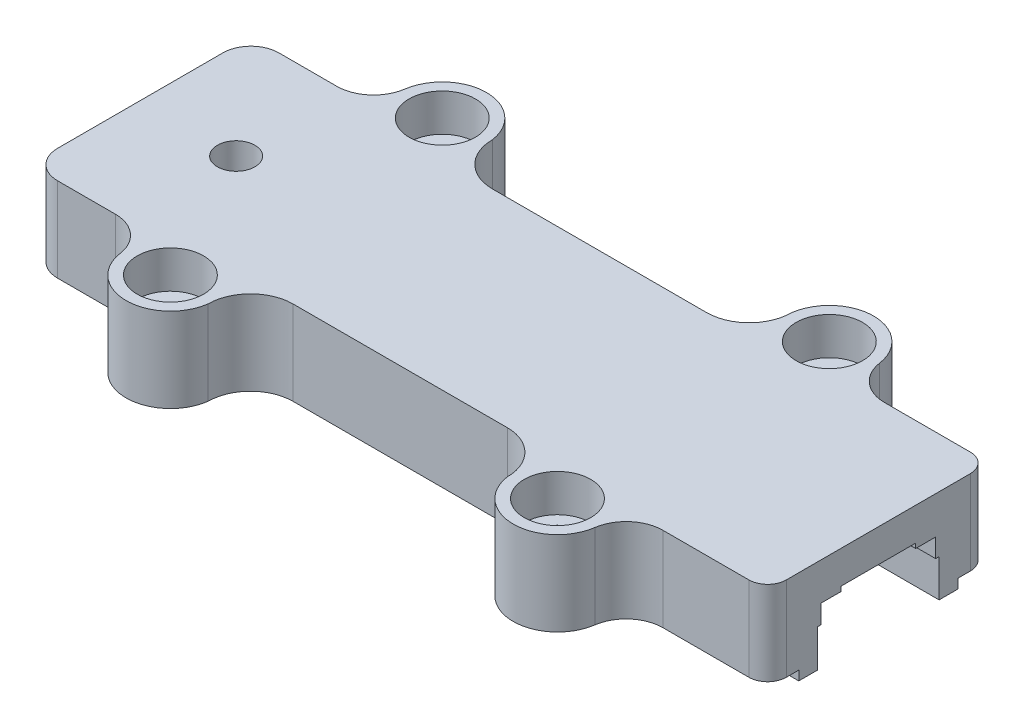
from build123d import *

# Parameters (mm, degrees)
SKETCH1_W           = 100
SKETCH1_H           = 30
BOSS_EXTRUDE1_DEPTH = 12.7
SKETCH2_W           = 15.2
SKETCH2_H           = 7.62
CUT_EXTRUDE1_DEPTH  = 102.913149299
SKETCH3_W           = 0.635
SKETCH3_H           = 5.08
SKETCH3_W_2         = 10.12
SKETCH3_H_2         = 0.635
CUT_EXTRUDE2_DEPTH  = 102.913149299
BOSS_EXTRUDE2_REACH = 103.913
SKETCH4_W           = 5
SKETCH4_H           = 16.47
FILLET7_R           = 1.5875
FILLET8_R           = 1.5875
BOSS_EXTRUDE3_REACH = 103.405
SKETCH9_W           = 19.05
SKETCH9_H           = 10.12
SKETCH7_R           = 2.54
CUT_EXTRUDE4_DEPTH  = 102.405445613
SKETCH10_R          = 3.175
CUT_EXTRUDE6_DEPTH  = 1.27
FILLET5_R           = 1.5875
BOSS_EXTRUDE4_DEPTH = 12.7
SKETCH12_R          = 4.5
CUT_EXTRUDE7_DEPTH  = 5.08
SKETCH13_R          = 2.75
CUT_EXTRUDE8_DEPTH  = 104.218974152
FILLET6_R           = 5
CUT_EXTRUDE9_START  = -1.27
CUT_EXTRUDE9_DEPTH  = 1.27
SKETCH25_W          = 3.175
SKETCH25_H          = 2.54
BOSS_EXTRUDE5_DEPTH = 2.54
BOSS_EXTRUDE6_REACH = 82.186
SKETCH26_W          = 2.54
SKETCH26_H          = 2.54
SKETCH31_W          = 0.1651
SKETCH31_H          = 2.54
ADJUST_DEPTH        = 72.14
FILLET9_R           = 1.5875
CUT_EXTRUDE10_DEPTH = 104.569962596
FILLET10_R          = 3.81
FILLET11_R          = 2.54


with BuildPart() as part:
    # Sketch1 → Boss-Extrude1 (new body)
    with BuildSketch(Plane(origin=(0, 0, 0), x_dir=(1, 0, 0), z_dir=(0, 1, 0))):
        with Locations((50, 0)):
            Rectangle(SKETCH1_W, SKETCH1_H)
    extrude(amount=BOSS_EXTRUDE1_DEPTH)

    # Sketch2 → Cut-Extrude1 (cut, through all)
    with BuildSketch(Plane(origin=(100, 0, 0), x_dir=(0, 0, -1), z_dir=(1, 0, 0))):
        with Locations((0, 3.81)):
            Rectangle(SKETCH2_W, SKETCH2_H)
    extrude(amount=-CUT_EXTRUDE1_DEPTH, mode=Mode.SUBTRACT)

    # Sketch3 → Cut-Extrude2 (cut, through all)
    with BuildSketch(Plane(origin=(100, 0, 0), x_dir=(0, 0, -1), z_dir=(1, 0, 0))):
        with Locations((-7.9175, 2.54)):
            Rectangle(SKETCH3_W, SKETCH3_H)
        with Locations((0, 7.9375)):
            Rectangle(SKETCH3_W_2, SKETCH3_H_2)
        with Locations((7.9175, 2.54)):
            Rectangle(SKETCH3_W, SKETCH3_H)
    extrude(amount=-CUT_EXTRUDE2_DEPTH, mode=Mode.SUBTRACT)

    # Sketch4 → Boss-Extrude2 (add, up to next)
    with BuildSketch(Plane.XZ, mode=Mode.PRIVATE) as boss_extrude2_sk1:
        with Locations((2.5, 0)):
            Rectangle(SKETCH4_W, SKETCH4_H)
    boss_extrude2_tool1 = extrude(boss_extrude2_sk1.sketch, amount=-BOSS_EXTRUDE2_REACH, mode=Mode.PRIVATE) - part.part
    add(boss_extrude2_tool1.solids().sort_by_distance((2.5, 0, 0))[0])

    # Fillet7
    fillet7_edges = [part.edges().sort_by_distance(p)[0] for p in [
        (5, 6.35, 7.6),
        (5, 6.35, -7.6),
    ]]
    fillet(fillet7_edges, radius=FILLET7_R)

    # Fillet8
    fillet8_edges = [part.edges().sort_by_distance(p)[0] for p in [
        (5, 2.54, 8.235),
        (5, 2.54, -8.235),
    ]]
    fillet(fillet8_edges, radius=FILLET8_R)

    # Sketch9 → Boss-Extrude3 (add, up to next)
    with BuildSketch(Plane.XZ.offset(-7.62), mode=Mode.PRIVATE) as boss_extrude3_sk1:
        with Locations((14.525, 0)):
            Rectangle(SKETCH9_W, SKETCH9_H)
    boss_extrude3_tool1 = extrude(boss_extrude3_sk1.sketch, amount=-BOSS_EXTRUDE3_REACH, mode=Mode.PRIVATE) - part.part
    add(boss_extrude3_tool1.solids().sort_by_distance((14.525, 7.62, 0))[0])

    # Sketch7 → Cut-Extrude4 (cut, through all)
    with BuildSketch(Plane.XZ.offset(-7.62)):
        with Locations(Location((13, 0, 0), (0, 0, 270))):
            Circle(SKETCH7_R)
    extrude(amount=-CUT_EXTRUDE4_DEPTH, mode=Mode.SUBTRACT)

    # Sketch10 → Cut-Extrude6 (cut)
    with BuildSketch(Plane.XZ.offset(-7.62)):
        with Locations(Location((13, 0, 0), (0, 0, 270))):
            Circle(SKETCH10_R)
    extrude(amount=-CUT_EXTRUDE6_DEPTH, mode=Mode.SUBTRACT)

    # Fillet5
    fillet5_edges = [part.edges().sort_by_distance(p)[0] for p in [
        (24.05, 7.9375, 5.06),
        (24.05, 7.9375, -5.06),
    ]]
    fillet(fillet5_edges, radius=FILLET5_R)

    # Sketch11 → Boss-Extrude4 (add)
    with BuildSketch(Plane(origin=(0, 12.7, 0), x_dir=(1, 0, 0), z_dir=(0, 1, 0))):
        with BuildLine():
            Line((68.95, -15), (68.95, -18.415))
            ThreePointArc((68.95, -18.415), (74.95, -24.415), (80.95, -18.415))
            Line((80.95, -18.415), (80.95, -15))
            Line((80.95, -15), (68.95, -15))
        make_face()
        with BuildLine():
            Line((28.51, -18.415), (28.51, -15))
            Line((28.51, -15), (16.51, -15))
            Line((16.51, -15), (16.51, -18.415))
            ThreePointArc((16.51, -18.415), (22.51, -24.415), (28.51, -18.415))
        make_face()
    boss_extrude4 = extrude(amount=-BOSS_EXTRUDE4_DEPTH)

    # Sketch12 → Cut-Extrude7 (cut)
    with BuildSketch(Plane(origin=(0, 12.7, 0), x_dir=(1, 0, 0), z_dir=(0, 1, 0))):
        with Locations(Location((22.51, -18.415, 0), (0, 0, 270))):
            Circle(SKETCH12_R)
        with Locations(Location((74.95, -18.415, 0), (0, 0, 270))):
            Circle(SKETCH12_R)
    cut_extrude7 = extrude(amount=-CUT_EXTRUDE7_DEPTH, mode=Mode.SUBTRACT)

    # Sketch13 → Cut-Extrude8 (cut, through all)
    with BuildSketch(Plane(origin=(0, 7.62, 0), x_dir=(1, 0, 0), z_dir=(0, 1, 0))):
        with Locations(Location((22.51, -18.415, 0), (0, 0, 270))):
            Circle(SKETCH13_R)
        with Locations(Location((74.95, -18.415, 0), (0, 0, 270))):
            Circle(SKETCH13_R)
    cut_extrude8 = extrude(amount=-CUT_EXTRUDE8_DEPTH, mode=Mode.SUBTRACT)

    # Mirror1: Boss-Extrude4, Cut-Extrude7, Cut-Extrude8 across plane
    add(boss_extrude4.mirror(Plane.XY))
    add(cut_extrude7.mirror(Plane.XY), mode=Mode.SUBTRACT)
    add(cut_extrude8.mirror(Plane.XY), mode=Mode.SUBTRACT)

    # Fillet6
    fillet6_edges = [part.edges().sort_by_distance(p)[0] for p in [
        (16.51, 6.35, 15),
        (28.51, 6.35, 15),
        (68.95, 6.35, 15),
        (80.95, 6.35, 15),
        (80.95, 6.35, -15),
        (68.95, 6.35, -15),
        (16.51, 6.35, -15),
        (28.51, 6.35, -15),
    ]]
    fillet(fillet6_edges, radius=FILLET6_R)

    # Sketch24 → Cut-Extrude9 (cut)
    with BuildSketch(Plane.XZ.offset(CUT_EXTRUDE9_START)):
        with BuildLine():
            Line((100, -10.775), (6.5875, -10.775))
            ThreePointArc((6.5875, -10.775), (3.668916761, -9.566083239), (2.46, -6.6475))
            Line((2.46, -6.6475), (2.46, 6.6475))
            ThreePointArc((2.46, 6.6475), (3.668916761, 9.566083239), (6.5875, 10.775))
            Line((6.5875, 10.775), (100, 10.775))
            Line((100, 10.775), (100, 15))
            Line((100, 15), (85.835209001, 15))
            ThreePointArc((85.835209001, 15), (82.564297257, 16.218315671), (80.887386728, 19.279545455))
            ThreePointArc((80.887386728, 19.279545455), (74.95, 24.415), (69.012613272, 19.279545455))
            ThreePointArc((69.012613272, 19.279545455), (67.335702743, 16.218315671), (64.064790999, 15))
            Line((64.064790999, 15), (33.395209001, 15))
            ThreePointArc((33.395209001, 15), (30.124297257, 16.218315671), (28.447386728, 19.279545455))
            ThreePointArc((28.447386728, 19.279545455), (22.51, 24.415), (16.572613272, 19.279545455))
            ThreePointArc((16.572613272, 19.279545455), (14.895702743, 16.218315671), (11.624790999, 15))
            Line((11.624790999, 15), (0, 15))
            Line((0, 15), (0, -15))
            Line((0, -15), (11.624790999, -15))
            ThreePointArc((11.624790999, -15), (14.895702743, -16.218315671), (16.572613272, -19.279545455))
            ThreePointArc((16.572613272, -19.279545455), (22.51, -24.415), (28.447386728, -19.279545455))
            ThreePointArc((28.447386728, -19.279545455), (30.124297257, -16.218315671), (33.395209001, -15))
            Line((33.395209001, -15), (64.064790999, -15))
            ThreePointArc((64.064790999, -15), (67.335702743, -16.218315671), (69.012613272, -19.279545455))
            ThreePointArc((69.012613272, -19.279545455), (74.95, -24.415), (80.887386728, -19.279545455))
            ThreePointArc((80.887386728, -19.279545455), (82.564297257, -16.218315671), (85.835209001, -15))
            Line((85.835209001, -15), (100, -15))
            Line((100, -15), (100, -10.775))
        make_face()
    extrude(amount=CUT_EXTRUDE9_DEPTH, mode=Mode.SUBTRACT)

    # Sketch25 → Boss-Extrude5 (add)
    with BuildSketch(Plane.XZ.offset(-7.62)):
        with Locations((26.2725, 6.33)):
            Rectangle(SKETCH25_W, SKETCH25_H)
        with Locations((26.2725, -6.33)):
            Rectangle(SKETCH25_W, SKETCH25_H)
    extrude(amount=BOSS_EXTRUDE5_DEPTH)

    # Sketch26 → Boss-Extrude6 (add, up to next)
    with BuildSketch(Plane.ZY.offset(-24.685), mode=Mode.PRIVATE) as boss_extrude6_sk1:
        with Locations((6.33, 6.35)):
            Rectangle(SKETCH26_W, SKETCH26_H)
    boss_extrude6_tool1 = extrude(boss_extrude6_sk1.sketch, amount=BOSS_EXTRUDE6_REACH, mode=Mode.PRIVATE) - part.part
    # Sketch26 → Boss-Extrude6 (add, up to next)
    with BuildSketch(Plane.ZY.offset(-24.685), mode=Mode.PRIVATE) as boss_extrude6_sk2:
        with Locations((-6.33, 6.35)):
            Rectangle(SKETCH26_W, SKETCH26_H)
    boss_extrude6_tool2 = extrude(boss_extrude6_sk2.sketch, amount=BOSS_EXTRUDE6_REACH, mode=Mode.PRIVATE) - part.part
    add(boss_extrude6_tool1.solids().sort_by_distance((24.685, 6.35, 6.33))[0])
    add(boss_extrude6_tool2.solids().sort_by_distance((24.685, 6.35, -6.33))[0])

    # Sketch31 → adjust (cut)
    with BuildSketch(Plane(origin=(100, 0, 0), x_dir=(0, 0, -1), z_dir=(1, 0, 0))):
        with Locations((7.68255, 6.35)):
            Rectangle(SKETCH31_W, SKETCH31_H)
        with Locations((-7.68255, 6.35)):
            Rectangle(SKETCH31_W, SKETCH31_H)
    extrude(amount=-ADJUST_DEPTH, mode=Mode.SUBTRACT)

    # Fillet9
    fillet9_edges = [part.edges().sort_by_distance(p)[0] for p in [
        (5, 6.35, 5.06),
        (5, 6.35, -5.06),
        (27.86, 6.35, 7.7651),
        (27.86, 6.35, -7.7651),
    ]]
    fillet(fillet9_edges, radius=FILLET9_R)

    # Sketch33 → Cut-Extrude10 (cut, through all)
    with BuildSketch(Plane.XZ.offset(-1.27)):
        with BuildLine():
            Line((28.447386728, 19.279545455), (28.447386728, 29.295040307))
            Line((28.447386728, 29.295040307), (69.012613272, 29.295040307))
            Line((69.012613272, 29.295040307), (69.012613272, 19.279545455))
            ThreePointArc((69.012613272, 19.279545455), (67.319823601, 15.192789671), (63.233067818, 13.5))
            Line((63.233067818, 13.5), (34.226932182, 13.5))
            ThreePointArc((34.226932182, 13.5), (30.140176399, 15.192789671), (28.447386728, 19.279545455))
        make_face()
        with BuildLine():
            Line((28.447386728, -19.279545455), (28.447386728, -29.295040307))
            Line((28.447386728, -29.295040307), (69.012613272, -29.295040307))
            Line((69.012613272, -29.295040307), (69.012613272, -19.279545455))
            ThreePointArc((69.012613272, -19.279545455), (67.319823601, -15.192789671), (63.233067818, -13.5))
            Line((63.233067818, -13.5), (34.226932182, -13.5))
            ThreePointArc((34.226932182, -13.5), (30.140176399, -15.192789671), (28.447386728, -19.279545455))
        make_face()
    extrude(amount=-CUT_EXTRUDE10_DEPTH, mode=Mode.SUBTRACT)

    # Fillet10
    fillet10_edges = [part.edges().sort_by_distance(p)[0] for p in [
        (0, 6.985, 15),
        (0, 6.985, -15),
    ]]
    fillet(fillet10_edges, radius=FILLET10_R)

    # Fillet11
    fillet11_edges = [part.edges().sort_by_distance(p)[0] for p in [
        (100, 6.985, 15),
        (100, 6.985, -15),
    ]]
    fillet(fillet11_edges, radius=FILLET11_R)


solid = part.part
